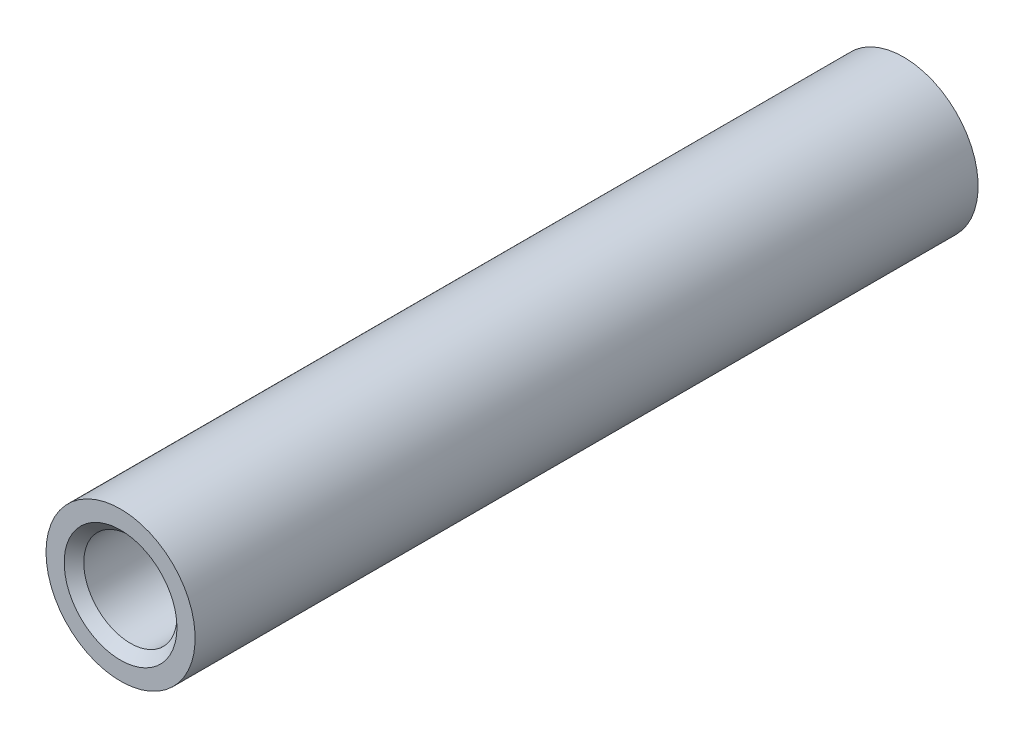
from build123d import *

# Parameters (mm, degrees)
ESBO_O1_R                = 4
RESSALTO_EXTRUS_O1_DEPTH = 21


with BuildPart() as part:
    # Esboço1 → Ressalto-extrusão1 (new, symmetric)
    with BuildSketch(Plane.XY):
        with Locations(Location((0, 0, 0), (0, 0, 180))):
            Circle(ESBO_O1_R)
    extrude(amount=RESSALTO_EXTRUS_O1_DEPTH, both=True)

    # Esboço3 → Furo roscado de M61 (revolve, cut)
    with BuildSketch(Plane(origin=(0, 0, 21), x_dir=(0, -1, 0), z_dir=(1, 0, 0))):
        Polygon((0, 0), (0, 16.502151548), (2.5, 15), (2.5, 0.525), (3.025, 0), align=None)
    furo_roscado_de_m61 = revolve(axis=Axis((0, 0, 27.35), (0, 0, -1)), mode=Mode.SUBTRACT)

    # Espelhar2: Furo roscado de M61 across plane
    add(furo_roscado_de_m61.mirror(Plane.XY), mode=Mode.SUBTRACT)


solid = part.part
